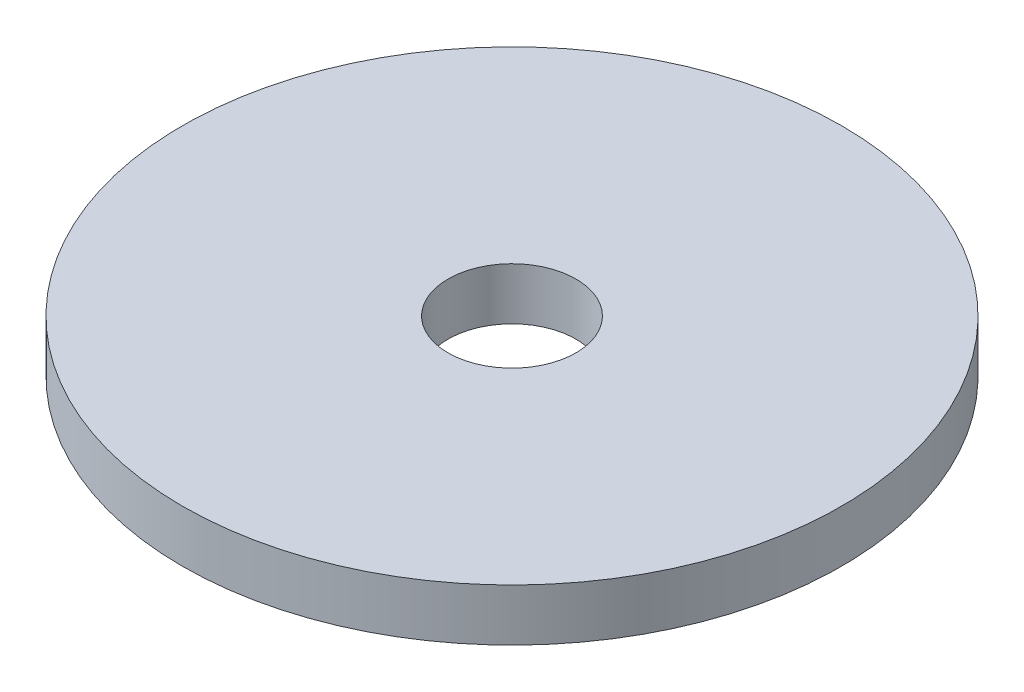
from build123d import *

# Parameters (mm, degrees)
SKETCH1_R           = 17.4
SKETCH1_R_2         = 3.3782
BOSS_EXTRUDE1_DEPTH = 2.75


with BuildPart() as part:
    # Sketch1 → Boss-Extrude1 (new body)
    with BuildSketch(Plane(origin=(0, 0, 0), x_dir=(1, 0, 0), z_dir=(0, 1, 0))):
        with Locations(Location((0, 0, 0), (0, 0, 270))):
            Circle(SKETCH1_R)
        with Locations(Location((0, 0, 0), (0, 0, 270))):
            Circle(SKETCH1_R_2, mode=Mode.SUBTRACT)
    extrude(amount=BOSS_EXTRUDE1_DEPTH)


solid = part.part
